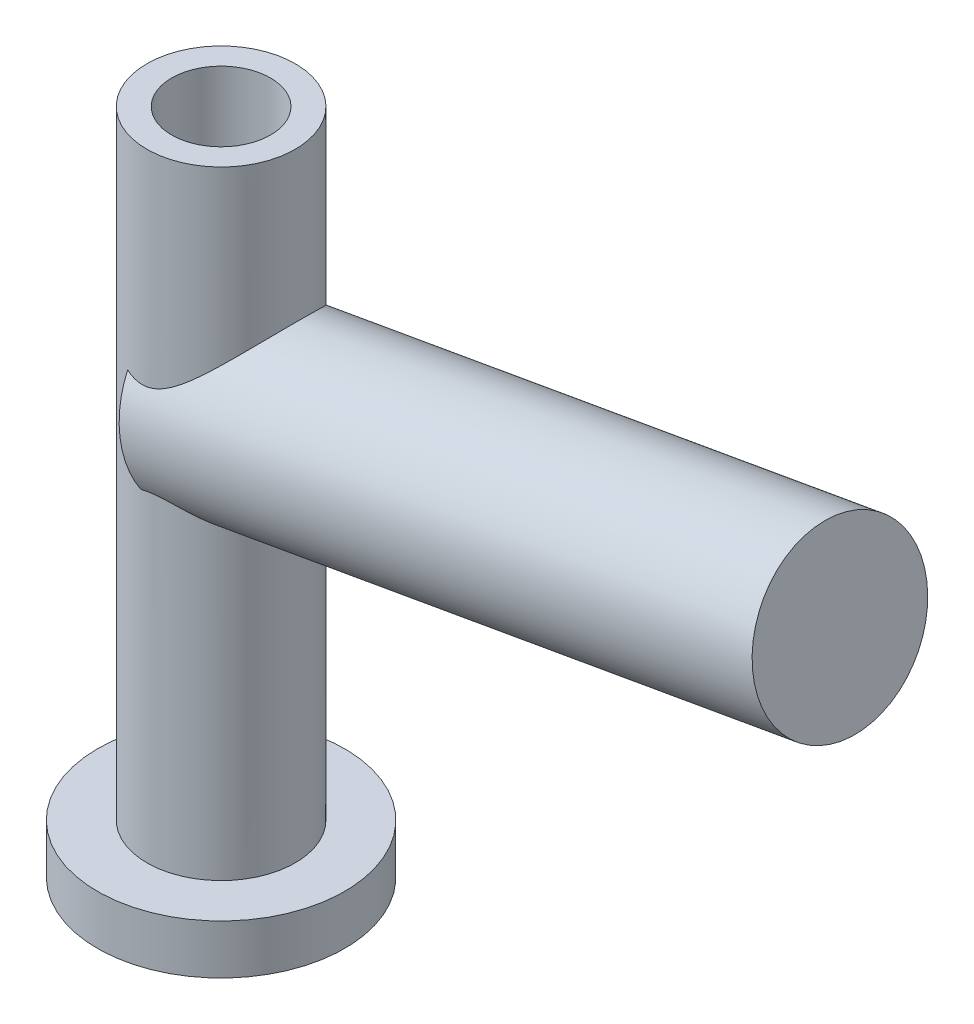
from build123d import *

# Parameters (mm, degrees)
SKETCH2_R           = 52.5
BOSS_EXTRUDE1_DEPTH = 390
SKETCH3_R           = 30
CUT_EXTRUDE1_DEPTH  = 564.537281534


with BuildPart() as part:
    # Sketch1 → Revolve1 (revolve)
    with BuildSketch(Plane.XY):
        Polygon((0, 202.5), (0, -202.5), (75, -202.5), (75, -172.5), (45, -172.5), (45, 202.5), align=None)
    revolve(axis=Axis((0, 202.5, 0), (0, -1, 0)))

    # Sketch2 → Boss-Extrude1 (add)
    with BuildSketch(Plane(origin=(0, 0, 0), x_dir=(0, 0, 1), z_dir=(0.984807753012208, 0.17364817766693072, 0))):
        with Locations((0, -49.423569985)):
            Circle(SKETCH2_R)
    extrude(amount=BOSS_EXTRUDE1_DEPTH)

    # Sketch3 → Cut-Extrude1 (cut, through all)
    with BuildSketch(Plane(origin=(0, 202.5, 0), x_dir=(1, 0, 0), z_dir=(0, 1, 0))):
        Circle(SKETCH3_R)
    extrude(amount=-CUT_EXTRUDE1_DEPTH, mode=Mode.SUBTRACT)


solid = part.part
